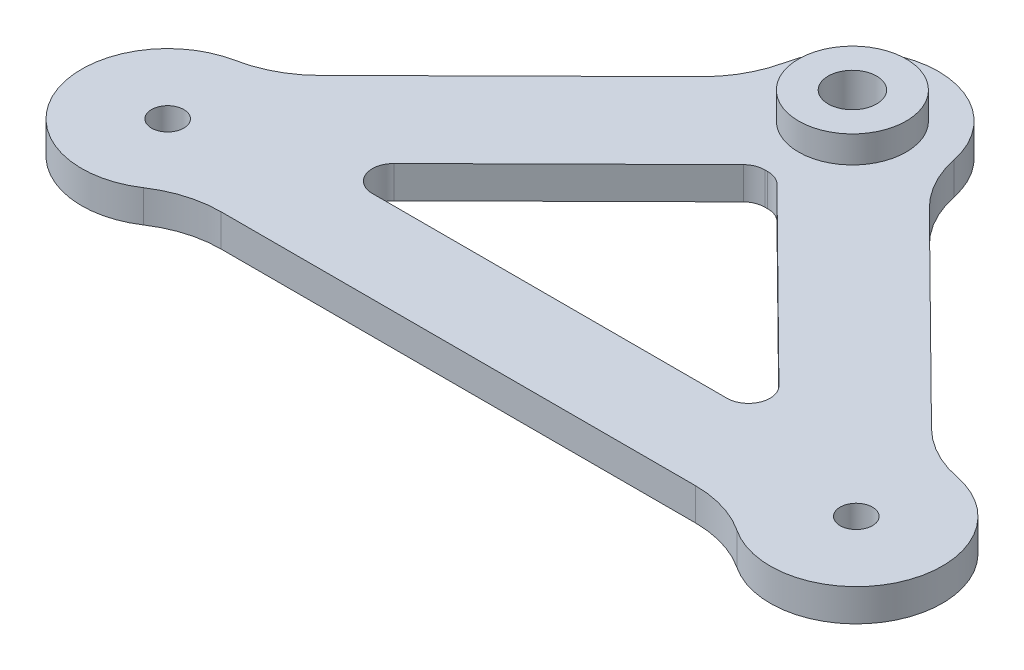
from build123d import *

# Parameters (mm, degrees)
SKETCH2_R                = 1.5
SKETCH2_R_2              = 5
BOSS_EXTRUDE1_DEPTH      = 3
FILLET1_R                = 10
FILLET2_R                = 2
BOSS_EXTRUDE2_DEPTH      = 2.5
BOSS_EXTRUDE2_DEPTH_BACK = 3
SKETCH3_R                = 5
SKETCH3_R_2              = 2.25


with BuildPart() as part:
    # Sketch2 → Boss-Extrude1 (new body)
    with BuildSketch(Plane(origin=(0, 0, 0), x_dir=(1, 0, 0), z_dir=(0, 1, 0))):
        with BuildLine():
            Line((-25.755002002, -7.091520556), (25.755002002, -7.091520556))
            ThreePointArc((25.755002002, -7.091520556), (39.399896119, -5.131510265), (31.07348397, 5.854646321))
            Line((31.07348397, 5.854646321), (7.956268299, 28.711722383))
            ThreePointArc((7.956268299, 28.711722383), (8.3294e-05, 37.547063483), (-7.956285692, 28.711888061))
            Line((-7.956285692, 28.711888061), (-31.074510761, 5.854765977))
            ThreePointArc((-31.074510761, 5.854765977), (-39.399699694, -5.131988356), (-25.755002002, -7.091520556))
        make_face()
        with Locations(Location((-32, -2.091520556, 0), (0, 0, 270))):
            Circle(SKETCH2_R, mode=Mode.SUBTRACT)
        with Locations(Location((32, -2.091520556, 0), (0, 0, 270))):
            Circle(SKETCH2_R, mode=Mode.SUBTRACT)
        with BuildLine():
            Line((0.92651603, 21.600896605), (21.348745942, 1.408479444))
            Line((21.348745942, 1.408479444), (-21.34844873, 1.408479444))
            Line((-21.34844873, 1.408479444), (-0.925489239, 21.60077695))
            ThreePointArc((-0.925489239, 21.60077695), (0.00051687, 21.5470635), (0.92651603, 21.600896605))
        make_face(mode=Mode.SUBTRACT)
        Polygon((0, 22.515813483), (0, 22.516986487), (0.000593189, 22.516399973), align=None, mode=Mode.SUBTRACT)
        with Locations(Location((0, 29.547063483, 0), (0, 0, 270))):
            Circle(SKETCH2_R_2, mode=Mode.SUBTRACT)
    extrude(amount=BOSS_EXTRUDE1_DEPTH)

    # Fillet1
    fillet1_edges = [part.edges().sort_by_distance(p)[0] for p in [
        (-25.755002002, 1.5, 7.091520556),
        (-31.074510761, 1.5, -5.854765977),
        (-7.956285692, 1.5, -28.711888061),
        (7.956268299, 1.5, -28.711722383),
        (31.07348397, 1.5, -5.854646321),
        (25.755002002, 1.5, 7.091520556),
    ]]
    fillet(fillet1_edges, radius=FILLET1_R)

    # Fillet2
    fillet2_edges = [part.edges().sort_by_distance(p)[0] for p in [
        (0.92651603, 1.5, -21.600896605),
        (-0.925489239, 1.5, -21.60077695),
        (-21.34844873, 1.5, -1.408479444),
        (21.348745942, 1.5, -1.408479444),
    ]]
    fillet(fillet2_edges, radius=FILLET2_R)


with BuildPart() as body_2:
    # Sketch3 → Boss-Extrude2 (new, two sides: drawn at the far end of the back side and taken through both)
    with BuildSketch(Plane(origin=(0, 3, 0), x_dir=(1, 0, 0), z_dir=(0, 1, 0)).offset(-BOSS_EXTRUDE2_DEPTH_BACK)):
        with Locations(Location((0, 29.547063483, 0), (0, 0, 270))):
            Circle(SKETCH3_R)
        with Locations(Location((0, 29.547063483, 0), (0, 0, 270))):
            Circle(SKETCH3_R_2, mode=Mode.SUBTRACT)
    extrude(amount=BOSS_EXTRUDE2_DEPTH + BOSS_EXTRUDE2_DEPTH_BACK)


solid = Compound([part.part, body_2.part])
